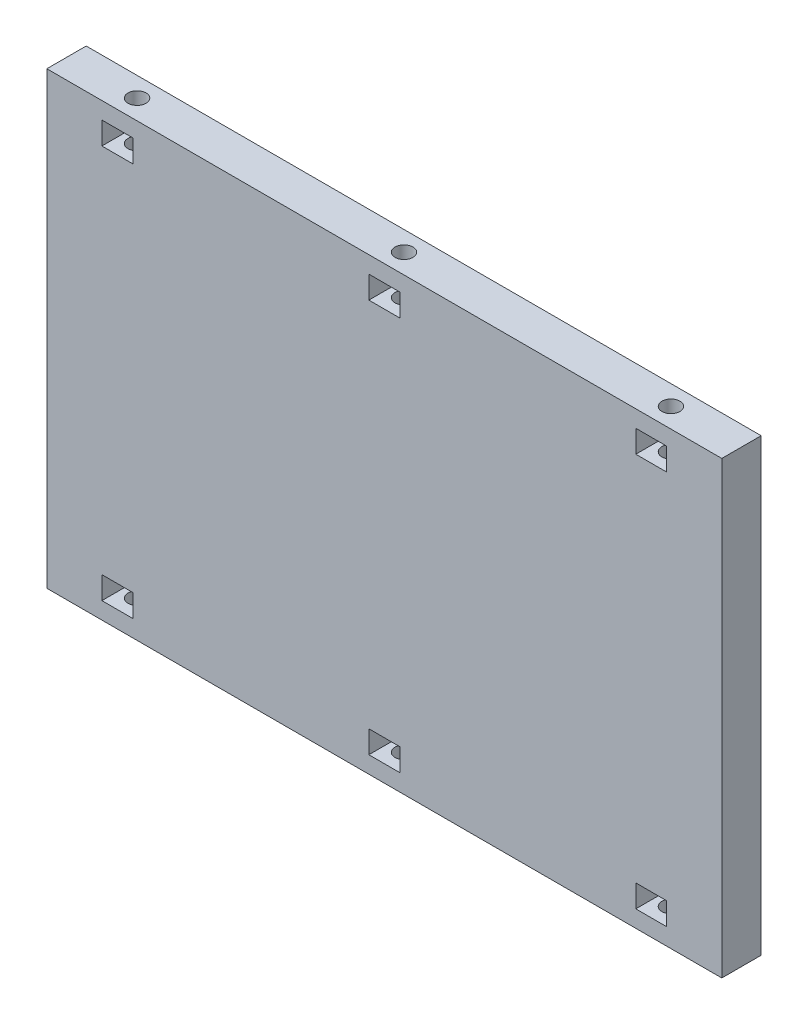
from build123d import *

# Parameters (mm, degrees)
ESBO_O1_W                = 120
ESBO_O1_H                = 80
ESBO_O1_W_2              = 5.5
ESBO_O1_H_2              = 4
RESSALTO_EXTRUS_O4_DEPTH = 7
CORTE_EXTRUS_O1_START    = -80
ESBO_O2_R                = 1.6
CORTE_EXTRUS_O1_DEPTH    = 10
CORTE_EXTRUS_O2_START    = -10
ESBO_O2_2_R              = 1.6
CORTE_EXTRUS_O2_DEPTH    = 10


with BuildPart() as part:
    # Esboço1 → Ressalto-extrusão4 (new body)
    with BuildSketch(Plane.XY):
        Rectangle(ESBO_O1_W, ESBO_O1_H)
        with Locations((-47.46, -35)):
            Rectangle(ESBO_O1_W_2, ESBO_O1_H_2, mode=Mode.SUBTRACT)
        with Locations((47.46, -35)):
            Rectangle(ESBO_O1_W_2, ESBO_O1_H_2, mode=Mode.SUBTRACT)
        with Locations((0, -35)):
            Rectangle(ESBO_O1_W_2, ESBO_O1_H_2, mode=Mode.SUBTRACT)
        with Locations((47.46, 35)):
            Rectangle(ESBO_O1_W_2, ESBO_O1_H_2, mode=Mode.SUBTRACT)
        with Locations((0, 35)):
            Rectangle(ESBO_O1_W_2, ESBO_O1_H_2, mode=Mode.SUBTRACT)
        with Locations((-47.46, 35)):
            Rectangle(ESBO_O1_W_2, ESBO_O1_H_2, mode=Mode.SUBTRACT)
    extrude(amount=RESSALTO_EXTRUS_O4_DEPTH)

    # Esboço2 → Corte-extrusão1 (cut)
    with BuildSketch(Plane(origin=(0, 40, 0), x_dir=(1, 0, 0), z_dir=(0, 1, 0)).offset(CORTE_EXTRUS_O1_START)):
        with Locations(Location((-47.46, -3.5, 0), (0, 0, 270))):
            Circle(ESBO_O2_R)
        with Locations(Location((0, -3.5, 0), (0, 0, 270))):
            Circle(ESBO_O2_R)
        with Locations((47.46, -3.5)):
            Circle(ESBO_O2_R)
    extrude(amount=CORTE_EXTRUS_O1_DEPTH, mode=Mode.SUBTRACT)

    # Esboço2<2> → Corte-extrusão2 (cut)
    with BuildSketch(Plane(origin=(0, 40, 0), x_dir=(1, 0, 0), z_dir=(0, 1, 0)).offset(CORTE_EXTRUS_O2_START)):
        with Locations(Location((-47.46, -3.5, 0), (0, 0, 270))):
            Circle(ESBO_O2_2_R)
        with Locations(Location((0, -3.5, 0), (0, 0, 270))):
            Circle(ESBO_O2_2_R)
        with Locations((47.46, -3.5)):
            Circle(ESBO_O2_2_R)
    extrude(amount=CORTE_EXTRUS_O2_DEPTH, mode=Mode.SUBTRACT)


solid = part.part
